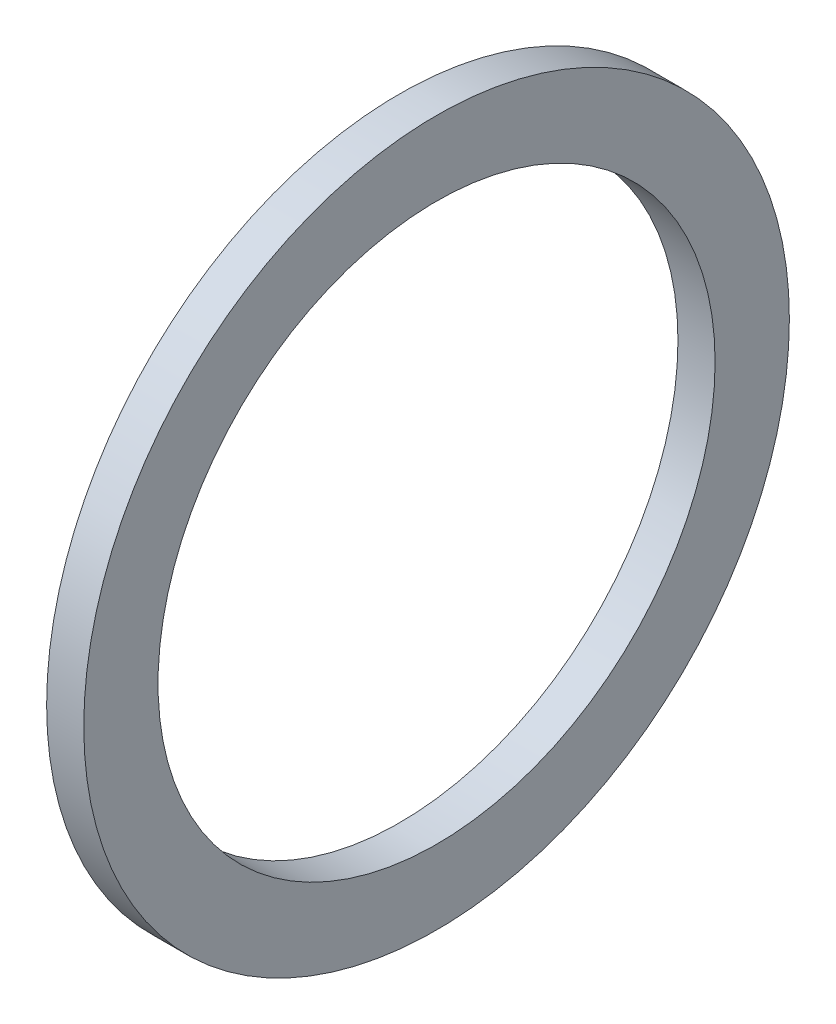
from build123d import *

# Parameters (mm, degrees)
SKETCH_1_R      = 47.5
SKETCH_1_R_2    = 37.5
EXTRUDE_1_DEPTH = 5


with BuildPart() as part:
    # Эскиз1 → Бобышка-Вытянуть1 (new body)
    with BuildSketch(Plane(origin=(0, 0, 0), x_dir=(0, 0, -1), z_dir=(1, 0, 0))):
        Circle(SKETCH_1_R)
        Circle(SKETCH_1_R_2, mode=Mode.SUBTRACT)
    extrude(amount=EXTRUDE_1_DEPTH)


solid = part.part
